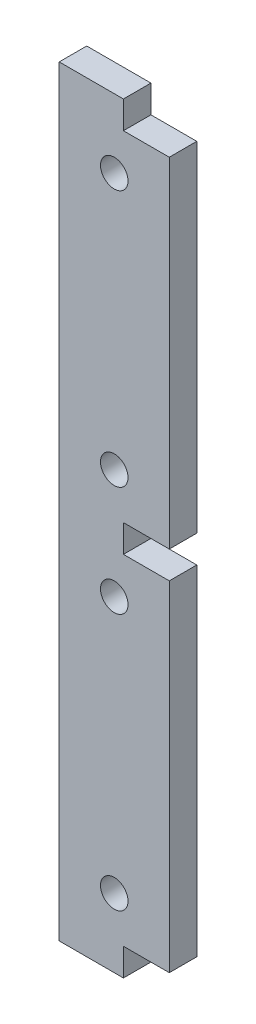
from build123d import *

# Parameters (mm, degrees)
ESQUISSE1_R             = 1.5
BOSS_EXTRU_1_DEPTH      = 3
ESQUISSE2_W             = 12
ESQUISSE2_H             = 17.5
ENL_V_MAT_EXTRU_1_DEPTH = 119.190524155


with BuildPart() as part:
    # Esquisse1 → Boss.-Extru.1 (new body)
    with BuildSketch(Plane.XY):
        Polygon((-6, 0), (6, 0), (6, 17.5), (1, 17.5), (1, 20.5), (6, 20.5), (6, 57.5), (1, 57.5), (1, 60.5), (6, 60.5), (6, 97.5), (1, 97.5), (1, 100.5), (6, 100.5), (6, 118), (-6, 118), align=None)
        with Locations((0, 105)):
            Circle(ESQUISSE1_R, mode=Mode.SUBTRACT)
        with Locations(Location((0, 93, 0), (0, 0, 180))):
            Circle(ESQUISSE1_R, mode=Mode.SUBTRACT)
        with Locations((0, 65)):
            Circle(ESQUISSE1_R, mode=Mode.SUBTRACT)
        with Locations(Location((0, 53, 0), (0, 0, 180))):
            Circle(ESQUISSE1_R, mode=Mode.SUBTRACT)
        with Locations((0, 25)):
            Circle(ESQUISSE1_R, mode=Mode.SUBTRACT)
        with Locations(Location((0, 13, 0), (0, 0, 180))):
            Circle(ESQUISSE1_R, mode=Mode.SUBTRACT)
    extrude(amount=BOSS_EXTRU_1_DEPTH)

    # Esquisse2 → Enlèv. mat.-Extru.1 (cut, through all)
    with BuildSketch(Plane.XY.offset(3)):
        with Locations((0, 109.25)):
            Rectangle(ESQUISSE2_W, ESQUISSE2_H)
        with Locations((0, 8.75)):
            Rectangle(ESQUISSE2_W, ESQUISSE2_H)
    extrude(amount=-ENL_V_MAT_EXTRU_1_DEPTH, mode=Mode.SUBTRACT)


solid = part.part
